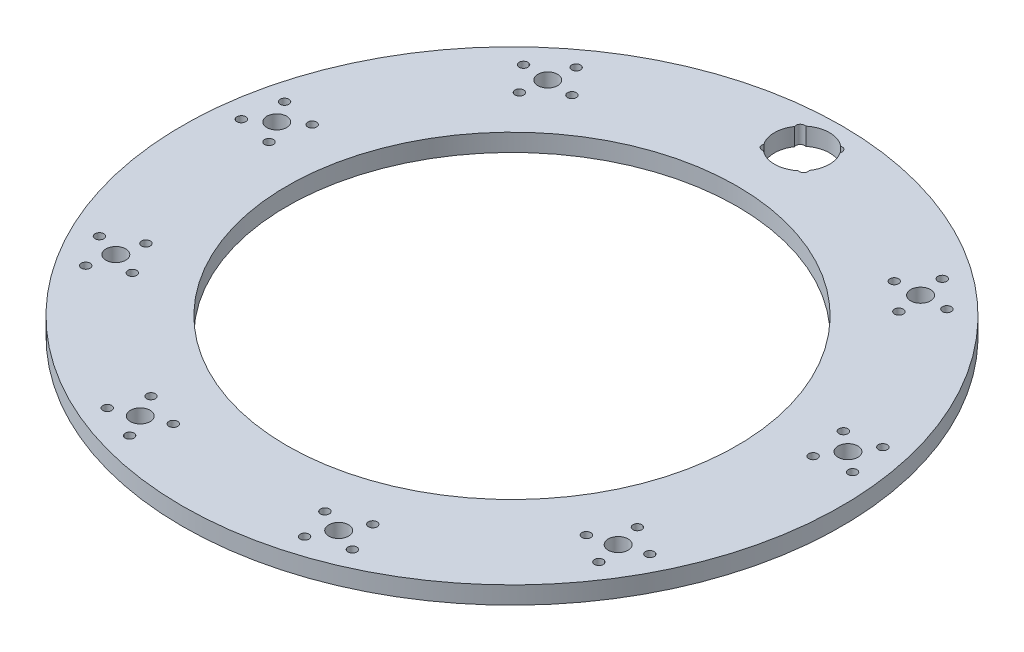
from build123d import *

# Parameters (mm, degrees)
SKETCH1_R           = 75
SKETCH1_R_2         = 51.2
BOSS_EXTRUDE1_DEPTH = 4
SKETCH2_R           = 2.25
SKETCH2_R_2         = 1
CUT_EXTRUDE1_DEPTH  = 107.141415103
CIRPATTERN1_COUNT   = 9
SKETCH3_R           = 6.25
CUT_EXTRUDE2_DEPTH  = 10


with BuildPart() as part:
    # Sketch1 → Boss-Extrude1 (new body)
    with BuildSketch(Plane(origin=(0, 0, 0), x_dir=(1, 0, 0), z_dir=(0, 1, 0))):
        Circle(SKETCH1_R)
        Circle(SKETCH1_R_2, mode=Mode.SUBTRACT)
    extrude(amount=BOSS_EXTRUDE1_DEPTH)

    # Sketch2 → Cut-Extrude1 (cut, through all)
    with BuildSketch(Plane(origin=(0, 4, 0), x_dir=(1, 0, 0), z_dir=(0, 1, 0))):
        with Locations((0, 66)):
            Circle(SKETCH2_R)
        with Locations((4.246572956, 69.876740658)):
            Circle(SKETCH2_R_2)
        with Locations((4.246572956, 62.123259342)):
            Circle(SKETCH2_R_2)
        with Locations((-4.246572956, 62.123259342)):
            Circle(SKETCH2_R_2)
        with Locations((-4.246572956, 69.876740658)):
            Circle(SKETCH2_R_2)
    cut_extrude1 = extrude(amount=-CUT_EXTRUDE1_DEPTH, mode=Mode.SUBTRACT)

    # CirPattern1: Cut-Extrude1 ×9 about axis
    cirpattern1_axis = Axis((0, -0.2, 0), (0, 1, 0))
    for i in range(1, CIRPATTERN1_COUNT):
        add(cut_extrude1.rotate(cirpattern1_axis, i * 360 / CIRPATTERN1_COUNT), mode=Mode.SUBTRACT)

    # Sketch3 → Cut-Extrude2 (cut)
    with BuildSketch(Plane(origin=(0, 4, 0), x_dir=(1, 0, 0), z_dir=(0, 1, 0))):
        with Locations((0, 66)):
            Circle(SKETCH3_R)
    extrude(amount=-CUT_EXTRUDE2_DEPTH, mode=Mode.SUBTRACT)


solid = part.part
